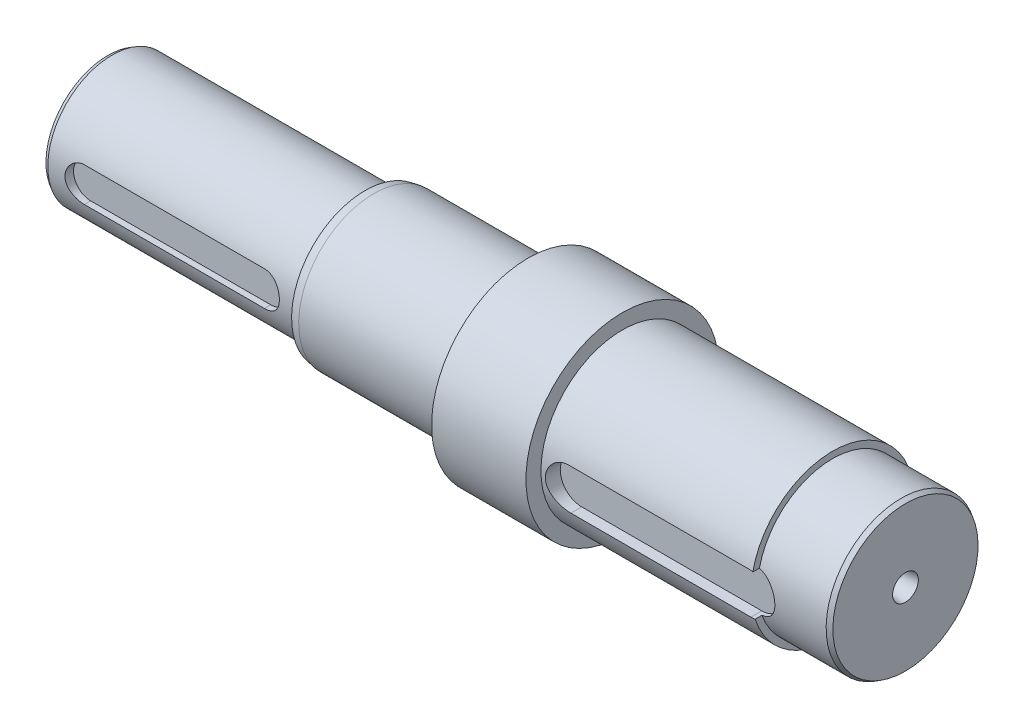
from build123d import *

# Parameters (mm, degrees)
CUT_EXTRUDE1_START = 15
CUT_EXTRUDE1_DEPTH = 2
CUT_EXTRUDE2_START = 15.5
CUT_EXTRUDE2_DEPTH = 25
SKETCH5_R          = 3
CUT_EXTRUDE3_DEPTH = 31
SKETCH9_R          = 3
CUT_EXTRUDE4_DEPTH = 6
CUT_EXTRUDE4_DRAFT = -8


with BuildPart() as part:
    # Sketch1 → Revolve1 (revolve)
    with BuildSketch(Plane.XY, mode=Mode.PRIVATE) as revolve1_sk:
        Polygon((-98.694744318, 0), (87.305255682, 0), (87.305255682, 16.922649731), (86.305255682, 17.5), (70.305255682, 17.5), (70.305255682, 19), (21.305255682, 19), (21.305255682, 22.5), (-0.694744318, 22.5), (-0.694744318, 17.5), (-36.694744318, 17.5), (-38.694744318, 17.147346039), (-38.694744318, 15), (-97.694744318, 15), (-98.694744318, 14.422649731), align=None)
    revolve(revolve1_sk.sketch.rotate(Axis((-98.694744318, 0, 0), (1, 0, 0)), 180), axis=Axis((-98.694744318, 0, 0), (1, 0, 0)))

    # Sketch2 → Cut-Extrude1 (cut)
    with BuildSketch(Plane.XY.offset(CUT_EXTRUDE1_START)):
        with BuildLine():
            Line((-89.694994324, 4.05), (-47.694994324, 4.05))
            ThreePointArc((-47.694994324, 4.05), (-43.694994324, 0.05), (-47.694994324, -3.95))
            Line((-47.694994324, -3.95), (-89.694994324, -3.95))
            ThreePointArc((-89.694994324, -3.95), (-93.694994324, 0.05), (-89.694994324, 4.05))
        make_face()
    extrude(amount=-CUT_EXTRUDE1_DEPTH, mode=Mode.SUBTRACT)

    # Sketch3 → Cut-Extrude2 (cut)
    with BuildSketch(Plane.XY.offset(CUT_EXTRUDE2_START)):
        with BuildLine():
            Line((27.305255682, 4), (69.305255682, 4))
            ThreePointArc((69.305255682, 4), (74.305255682, -1), (69.305255682, -6))
            Line((69.305255682, -6), (27.305255682, -6))
            ThreePointArc((27.305255682, -6), (22.305255682, -1), (27.305255682, 4))
        make_face()
    extrude(amount=CUT_EXTRUDE2_DEPTH, mode=Mode.SUBTRACT)

    # Sketch5 → Cut-Extrude3 (cut)
    with BuildSketch(Plane.ZY.offset(98.694744318)):
        Circle(SKETCH5_R)
    extrude(amount=-CUT_EXTRUDE3_DEPTH, mode=Mode.SUBTRACT)


with BuildPart() as cut_extrude4_tool:
    # Sketch9 → Cut-Extrude4 (with draft: the straight prism first)
    with BuildSketch(Plane(origin=(87.305255682, 0, 0), x_dir=(0, 0, -1), z_dir=(1, 0, 0))):
        with Locations(Location((0, 0, 0), (0, 0, 180))):
            Circle(SKETCH9_R)
    extrude(amount=-CUT_EXTRUDE4_DEPTH)
    # Cut-Extrude4: the draft: its side faces are tilted about the plane it starts from
    cut_extrude4_sides = [cut_extrude4_tool.faces().sort_by_distance(p)[0] for p in [
        (84.305255682, 0, -3),
    ]]
    draft(cut_extrude4_sides, Plane(origin=(87.305255682, 0, 0), x_dir=(0, 0, -1), z_dir=(1, 0, 0)), CUT_EXTRUDE4_DRAFT)


with BuildPart() as part_1:
    add(part.part)

    # Cut-Extrude4: cut by cut_extrude4_tool
    add(cut_extrude4_tool.part, mode=Mode.SUBTRACT)


solid = part_1.part
